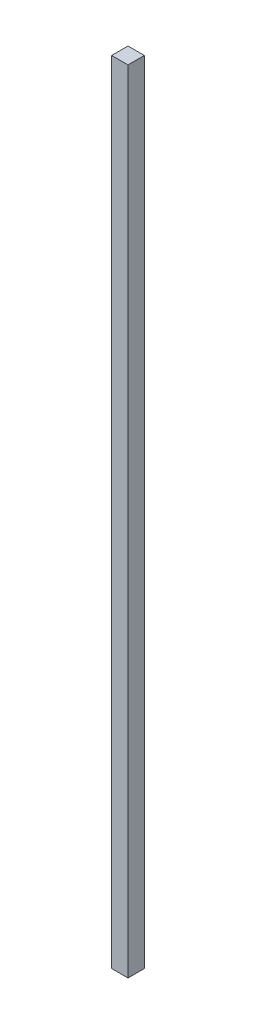
from build123d import *

# Parameters (mm, degrees)
SKETCH12_W               = 207
SKETCH12_H               = 207
HW5_SMALLBEAM207_1_DEPTH = 10000


with BuildPart() as part:
    # Sketch12 → Hw5 SMALLBEAM207(1) (new body)
    with BuildSketch(Plane.ZX):
        Rectangle(SKETCH12_W, SKETCH12_H)
    extrude(amount=HW5_SMALLBEAM207_1_DEPTH)


solid = part.part
